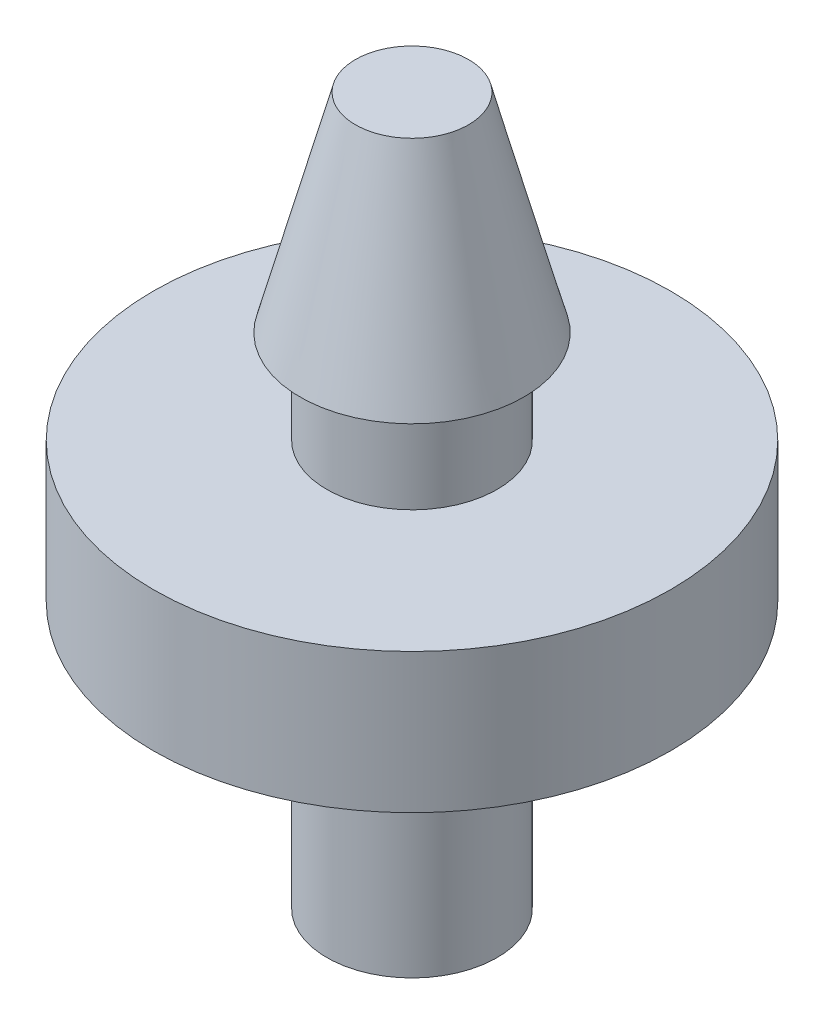
from build123d import *

# Parameters (mm, degrees)
SKETCH1_W = 0.94
SKETCH1_H = 16.81


with BuildPart() as part:
    # Sketch1 → Revolve1 (revolve)
    with BuildSketch(Plane.XY, mode=Mode.PRIVATE) as revolve1_sk:
        Polygon((-2.025, 0), (-0.94, 0), (-0.94, 16.81), (-1.345, 16.81), (-2.66, 11.86), (-2.025, 11.86), (-2.025, 9.64), (-6.15, 9.64), (-6.15, 6.32), (-2.025, 6.32), align=None)
        with Locations((-0.47, 8.405)):
            Rectangle(SKETCH1_W, SKETCH1_H)
    revolve(revolve1_sk.sketch.rotate(Axis((0, -0.095863309, 0), (0, 1, 0)), 270), axis=Axis((0, -0.095863309, 0), (0, 1, 0)))


solid = part.part
